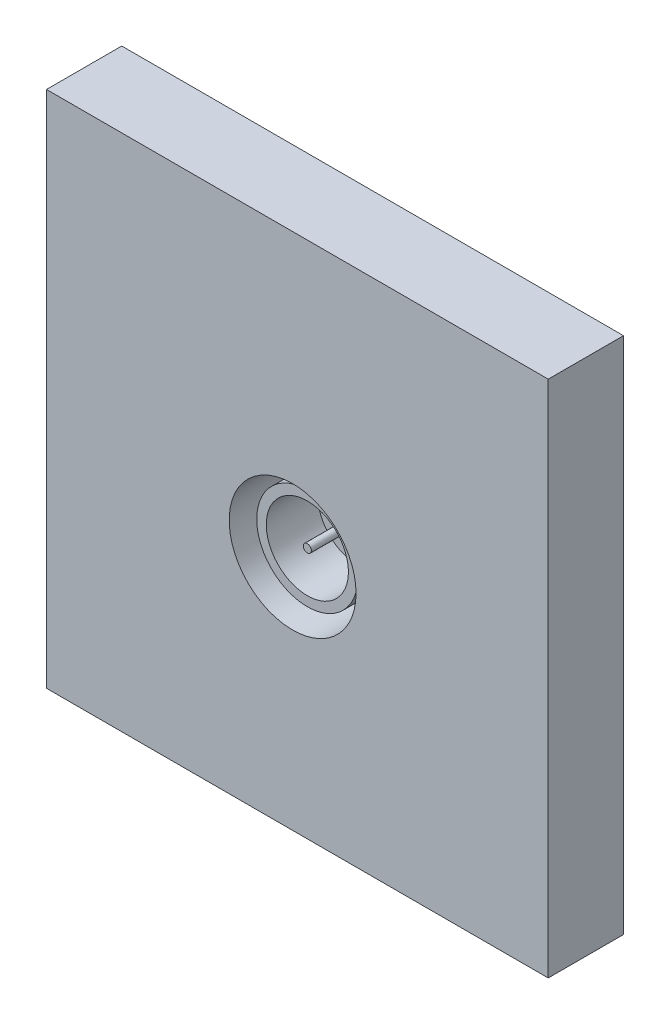
from build123d import *

# Parameters (mm, degrees)
BOSS_EXTRUDE1_DEPTH      = 6196
BOSS_EXTRUDE1_DEPTH_BACK = 4329
SKETCH1_W                = 1578.701976668
SKETCH1_H                = 10878.961606317
SKETCH3_R                = 1330.449328347
CUT_EXTRUDE1_DEPTH       = 1384
SKETCH4_R                = 84.807211279
BOSS_EXTRUDE2_DEPTH      = 1270
SKETCH5_R                = 1061.615772672
SKETCH5_R_2              = 861.273399979
BOSS_EXTRUDE3_DEPTH      = 10
BOSS_EXTRUDE4_START      = -1270
SKETCH5_2_R              = 1061.615772672
SKETCH5_2_R_2            = 861.273399979
BOSS_EXTRUDE4_DEPTH      = 1270


with BuildPart() as part:
    # Sketch1 → Boss-Extrude1 (new, two sides: drawn at the far end of the back side and taken through both)
    with BuildSketch(Plane(origin=(0, 0, 0), x_dir=(0, 0, -1), z_dir=(1, 0, 0)).offset(-BOSS_EXTRUDE1_DEPTH_BACK)):
        with Locations((-154.159787834, -728.170853353)):
            Rectangle(SKETCH1_W, SKETCH1_H)
    extrude(amount=BOSS_EXTRUDE1_DEPTH + BOSS_EXTRUDE1_DEPTH_BACK)

    # Sketch3 → Cut-Extrude1 (cut)
    with BuildSketch(Plane.XY.offset(943.510776168)):
        with Locations((833.930631376, -1197.16637306)):
            Circle(SKETCH3_R)
    extrude(amount=-CUT_EXTRUDE1_DEPTH, mode=Mode.SUBTRACT)

    # Sketch4 → Boss-Extrude2 (add)
    with BuildSketch(Plane(origin=(0, 0, -635.1912005), x_dir=(-1, 0, 0), z_dir=(0, 0, -1))):
        with Locations((-833.930631376, -1197.16637306)):
            Circle(SKETCH4_R)
    extrude(amount=-BOSS_EXTRUDE2_DEPTH)

    # Sketch5 → Boss-Extrude3 (add)
    with BuildSketch(Plane(origin=(0, 0, -635.1912005), x_dir=(-1, 0, 0), z_dir=(0, 0, -1))):
        with Locations((-833.930631376, -1197.16637306)):
            Circle(SKETCH5_R)
        with Locations((-833.930631376, -1197.16637306)):
            Circle(SKETCH5_R_2, mode=Mode.SUBTRACT)
    extrude(amount=BOSS_EXTRUDE3_DEPTH)

    # Sketch5<2> → Boss-Extrude4 (add)
    with BuildSketch(Plane(origin=(0, 0, -635.1912005), x_dir=(-1, 0, 0), z_dir=(0, 0, -1)).offset(BOSS_EXTRUDE4_START)):
        with Locations((-833.930631376, -1197.16637306)):
            Circle(SKETCH5_2_R)
        with Locations((-833.930631376, -1197.16637306)):
            Circle(SKETCH5_2_R_2, mode=Mode.SUBTRACT)
    extrude(amount=BOSS_EXTRUDE4_DEPTH)


solid = part.part
